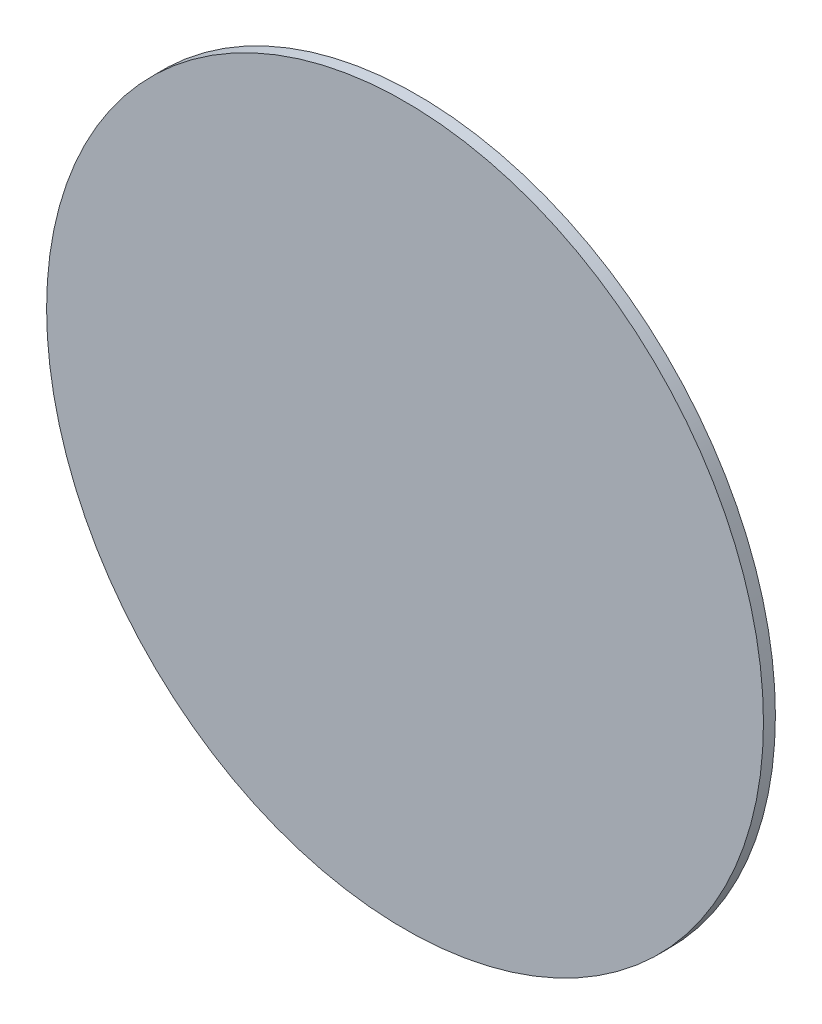
from build123d import *

# Parameters (mm, degrees)
SKETCH1_R           = 60
BOSS_EXTRUDE1_DEPTH = 2


with BuildPart() as part:
    # Sketch1 → Boss-Extrude1 (new body)
    with BuildSketch(Plane.XY):
        with Locations((-203.264344311, 322.302444851)):
            Circle(SKETCH1_R)
    extrude(amount=BOSS_EXTRUDE1_DEPTH)


solid = part.part
